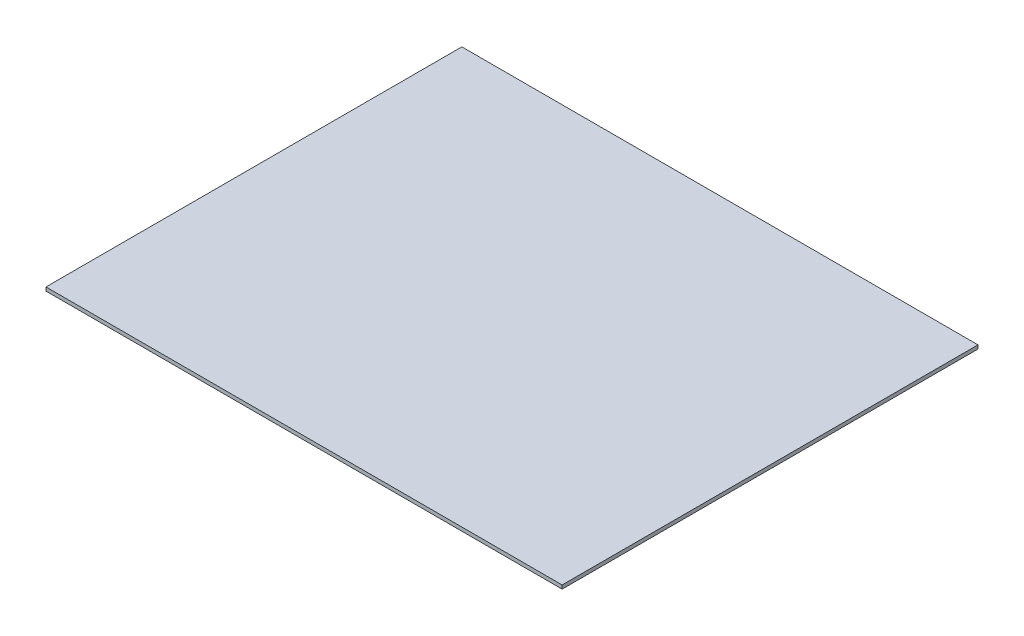
from build123d import *

# Parameters (mm, degrees)
SKETCH1_W   = 247
SKETCH1_H   = 199
SHAPE_DEPTH = 1.75


with BuildPart() as part:
    # Sketch1 → Shape (new body)
    with BuildSketch(Plane(origin=(0, 0, 0), x_dir=(1, 0, 0), z_dir=(0, 1, 0))):
        Rectangle(SKETCH1_W, SKETCH1_H)
    extrude(amount=SHAPE_DEPTH)


solid = part.part
